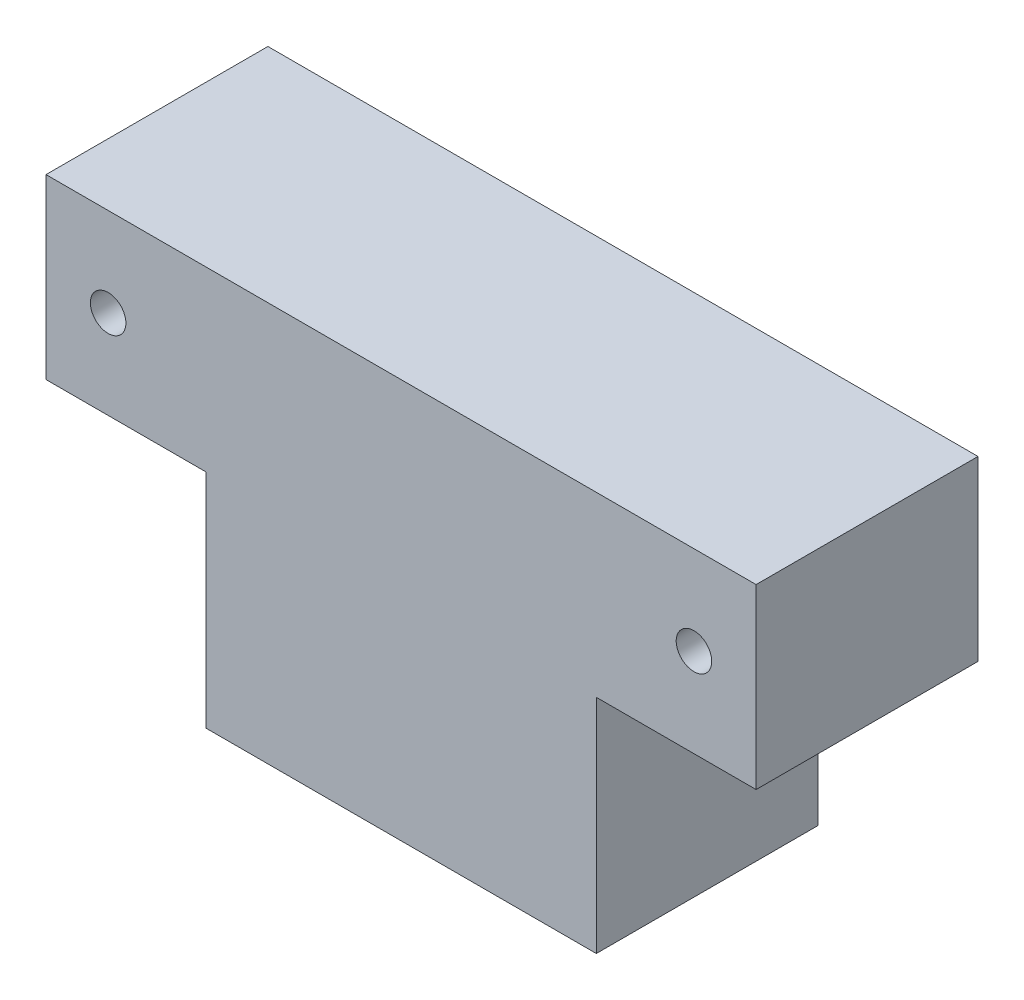
from build123d import *

# Parameters (mm, degrees)
IZIM1_R                     = 2
Y_KSEKLIK_EKSTR_ZYON1_DEPTH = 25


with BuildPart() as part:
    # Çizim1 → Yükseklik-Ekstrüzyon1 (new body)
    with BuildSketch(Plane.XY):
        Polygon((-22, -10), (-40, -10), (-40, 10), (40, 10), (40, -10), (22, -10), (22, -35), (-22, -35), align=None)
        with Locations((33, 0)):
            Circle(IZIM1_R, mode=Mode.SUBTRACT)
        with Locations((-33, 0)):
            Circle(IZIM1_R, mode=Mode.SUBTRACT)
    extrude(amount=Y_KSEKLIK_EKSTR_ZYON1_DEPTH)


solid = part.part
